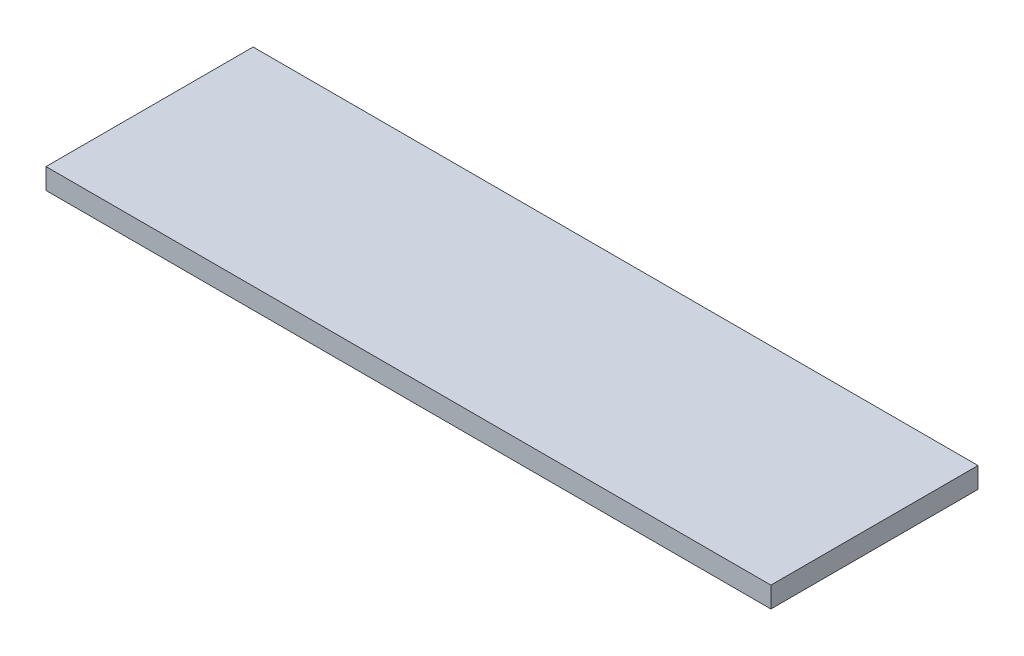
from build123d import *

# Parameters (mm, degrees)
SKETCH1_W           = 70
SKETCH1_H           = 20
BOSS_EXTRUDE1_DEPTH = 2


with BuildPart() as part:
    # Sketch1 → Boss-Extrude1 (new body)
    with BuildSketch(Plane(origin=(0, 0, 0), x_dir=(1, 0, 0), z_dir=(0, 1, 0))):
        Rectangle(SKETCH1_W, SKETCH1_H)
    extrude(amount=BOSS_EXTRUDE1_DEPTH)


solid = part.part
